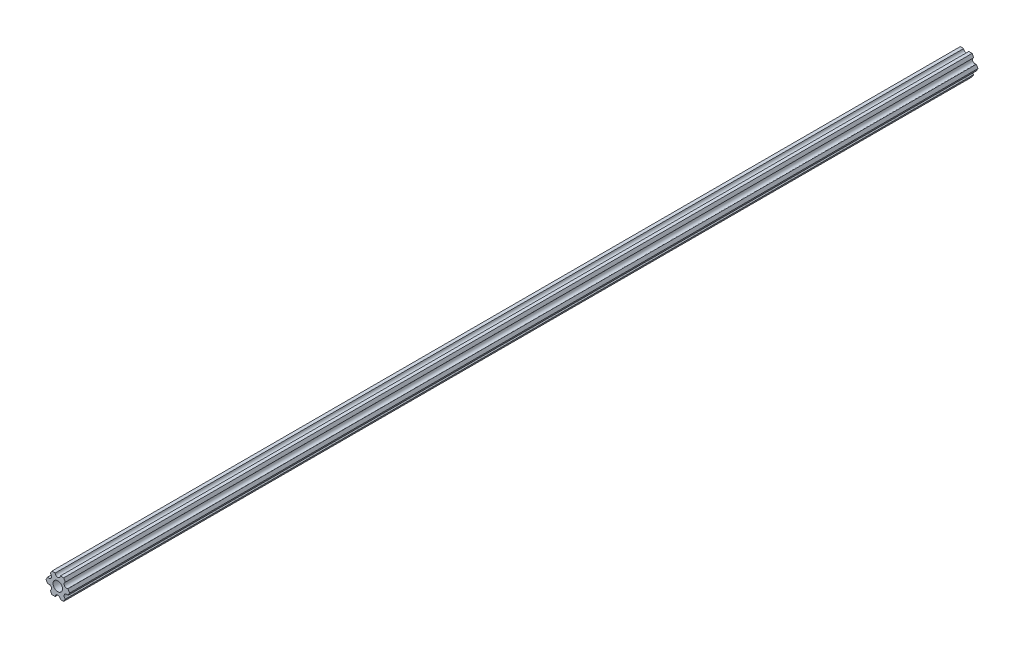
from build123d import *

# Parameters (mm, degrees)
SKETCH1_R           = 2.9337
BOSS_EXTRUDE1_DEPTH = 282.575


with BuildPart() as part:
    # Sketch1 → Boss-Extrude1 (new, symmetric)
    with BuildSketch(Plane.XY):
        with BuildLine():
            Line((-1.587500385, 6.349999904), (-3.666174594, 6.349999778))
            Line((-3.666174594, 6.349999778), (-4.70551159, 4.549815043))
            ThreePointArc((-4.70551159, 4.549815043), (-4.12444613, 2.38124975), (-6.293011423, 1.80018429))
            Line((-6.293011423, 1.80018429), (-7.332348419, -4.44e-07))
            Line((-7.332348419, -4.44e-07), (-6.293011205, -1.800185053))
            ThreePointArc((-6.293011205, -1.800185053), (-4.124445841, -2.38125025), (-4.705511038, -4.549815614))
            Line((-4.705511038, -4.549815614), (-3.666173825, -6.350000222))
            Line((-3.666173825, -6.350000222), (-1.587499615, -6.350000096))
            ThreePointArc((-1.587499615, -6.350000096), (2.89e-07, -4.7625), (1.587500385, -6.349999904))
            Line((1.587500385, -6.349999904), (3.666174594, -6.349999778))
            Line((3.666174594, -6.349999778), (4.70551159, -4.549815043))
            ThreePointArc((4.70551159, -4.549815043), (4.12444613, -2.38124975), (6.293011423, -1.80018429))
            Line((6.293011423, -1.80018429), (7.332348419, 4.44e-07))
            Line((7.332348419, 4.44e-07), (6.293011205, 1.800185053))
            ThreePointArc((6.293011205, 1.800185053), (4.124445841, 2.38125025), (4.705511038, 4.549815614))
            Line((4.705511038, 4.549815614), (3.666173825, 6.350000222))
            Line((3.666173825, 6.350000222), (1.587499615, 6.350000096))
            ThreePointArc((1.587499615, 6.350000096), (-2.89e-07, 4.7625), (-1.587500385, 6.349999904))
        make_face()
        Circle(SKETCH1_R, mode=Mode.SUBTRACT)
    extrude(amount=BOSS_EXTRUDE1_DEPTH, both=True)


solid = part.part
